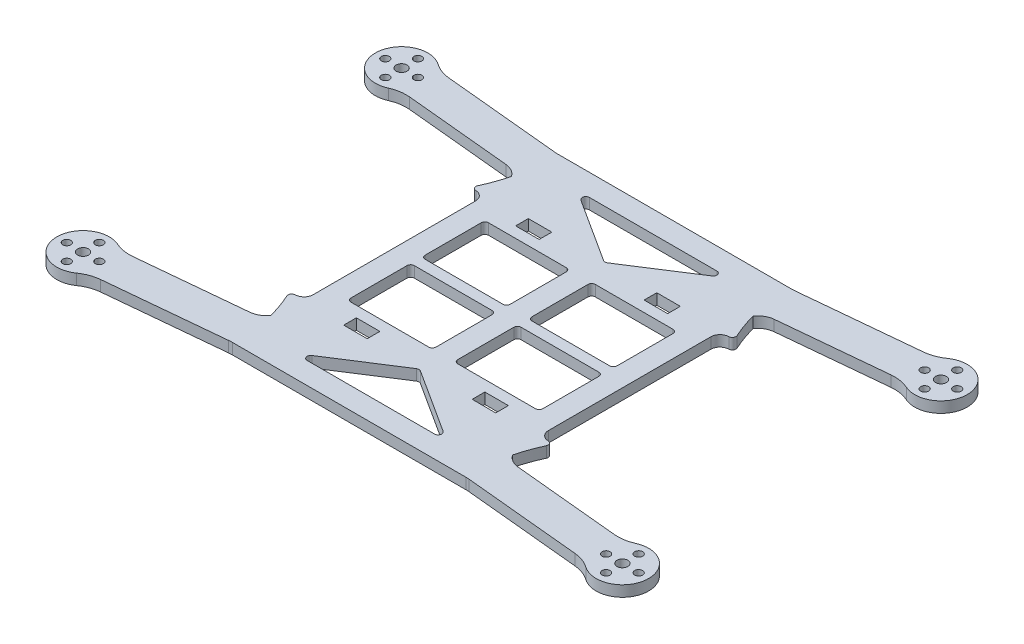
from build123d import *

# Parameters (mm, degrees)
SKETCH1_R           = 1.1
SKETCH1_R_2         = 1.099999998
SKETCH1_R_3         = 1.100000002
SKETCH1_R_4         = 1.100000004
SKETCH1_R_5         = 1.099999996
SKETCH1_R_6         = 1.5
BOSS_EXTRUDE1_DEPTH = 3
SKETCH2_W           = 6.5
SKETCH2_H           = 3.5
CUT_EXTRUDE1_DEPTH  = 3


with BuildPart() as part:
    # Sketch1 → Boss-Extrude1 (new body)
    with BuildSketch(Plane(origin=(0, 0, 0), x_dir=(1, 0, 0), z_dir=(0, 1, 0))):
        with BuildLine():
            Line((-65.541413555, 48.16007559), (-33.218669872, 45.046086874))
            ThreePointArc((-33.218669872, 45.046086874), (-32.739740879, 45.011528364), (-32.25970508, 45))
            Line((-32.25970508, 45), (32.25970508, 45))
            ThreePointArc((32.25970508, 45), (32.739740879, 45.011528364), (33.218669872, 45.046086874))
            Line((33.218669872, 45.046086874), (65.541413555, 48.16007559))
            ThreePointArc((65.541413555, 48.16007559), (68.051615849, 48.735029299), (70.331753828, 49.931966272))
            ThreePointArc((70.331753828, 49.931966272), (81.716587017, 44.695249474), (71.540883348, 37.381380156))
            ThreePointArc((71.540883348, 37.381380156), (69.074176187, 38.121003778), (66.500378347, 38.206162463))
            Line((66.500378347, 38.206162463), (37.020517604, 35.366058461))
            ThreePointArc((37.020517604, 35.366058461), (34.967820887, 34.700490182), (33.386772404, 33.231874971))
            ThreePointArc((33.386772404, 33.231874971), (34.463229219, 29.741424145), (35.835420758, 26.3562954))
            ThreePointArc((35.835420758, 26.3562954), (35.77253489, 25.409347753), (34.946904251, 24.941374967))
            ThreePointArc((34.946904251, 24.941374967), (33.213559493, 24.190832889), (32.5, 22.441938863))
            Line((32.5, 22.441938863), (32.5, -22.441938863))
            ThreePointArc((32.5, -22.441938863), (33.213559493, -24.190832889), (34.946904251, -24.941374967))
            ThreePointArc((34.946904251, -24.941374967), (35.77253489, -25.409347753), (35.835420758, -26.3562954))
            ThreePointArc((35.835420758, -26.3562954), (34.463229219, -29.741424145), (33.386772404, -33.231874971))
            ThreePointArc((33.386772404, -33.231874971), (34.967820887, -34.700490182), (37.020517604, -35.366058461))
            Line((37.020517604, -35.366058461), (66.500378347, -38.206162463))
            ThreePointArc((66.500378347, -38.206162463), (69.074176187, -38.121003778), (71.540883348, -37.381380156))
            ThreePointArc((71.540883348, -37.381380156), (81.716587017, -44.695249474), (70.331753828, -49.931966272))
            ThreePointArc((70.331753828, -49.931966272), (68.051615849, -48.735029299), (65.541413555, -48.16007559))
            Line((65.541413555, -48.16007559), (33.218669872, -45.046086874))
            ThreePointArc((33.218669872, -45.046086874), (32.739740879, -45.011528364), (32.25970508, -45))
            Line((32.25970508, -45), (-32.25970508, -45))
            ThreePointArc((-32.25970508, -45), (-32.739740879, -45.011528364), (-33.218669872, -45.046086874))
            Line((-33.218669872, -45.046086874), (-65.541413555, -48.16007559))
            ThreePointArc((-65.541413555, -48.16007559), (-68.051615849, -48.735029299), (-70.331753828, -49.931966272))
            ThreePointArc((-70.331753828, -49.931966272), (-81.716587017, -44.695249474), (-71.540883348, -37.381380156))
            ThreePointArc((-71.540883348, -37.381380156), (-69.074176187, -38.121003778), (-66.500378347, -38.206162463))
            Line((-66.500378347, -38.206162463), (-37.020517604, -35.366058461))
            ThreePointArc((-37.020517604, -35.366058461), (-34.967820887, -34.700490182), (-33.386772404, -33.231874971))
            ThreePointArc((-33.386772404, -33.231874971), (-34.463229219, -29.741424145), (-35.835420758, -26.3562954))
            ThreePointArc((-35.835420758, -26.3562954), (-35.77253489, -25.409347753), (-34.946904251, -24.941374967))
            ThreePointArc((-34.946904251, -24.941374967), (-33.213559493, -24.190832889), (-32.5, -22.441938863))
            Line((-32.5, -22.441938863), (-32.5, 22.441938863))
            ThreePointArc((-32.5, 22.441938863), (-33.213559493, 24.190832889), (-34.946904251, 24.941374967))
            ThreePointArc((-34.946904251, 24.941374967), (-35.77253489, 25.409347753), (-35.835420758, 26.3562954))
            ThreePointArc((-35.835420758, 26.3562954), (-34.463229219, 29.741424145), (-33.386772404, 33.231874971))
            ThreePointArc((-33.386772404, 33.231874971), (-34.967820887, 34.700490182), (-37.020517604, 35.366058461))
            Line((-37.020517604, 35.366058461), (-66.500378347, 38.206162463))
            ThreePointArc((-66.500378347, 38.206162463), (-69.074176187, 38.121003778), (-71.540883348, 37.381380156))
            ThreePointArc((-71.540883348, 37.381380156), (-81.716587017, 44.695249474), (-70.331753828, 49.931966272))
            ThreePointArc((-70.331753828, 49.931966272), (-68.051615849, 48.735029299), (-65.541413555, 48.16007559))
        make_face()
        with Locations(Location((-79, 44, 0), (0, 0, 270))):
            Circle(SKETCH1_R, mode=Mode.SUBTRACT)
        with Locations(Location((79, 44, 0), (0, 0, 270))):
            Circle(SKETCH1_R, mode=Mode.SUBTRACT)
        with Locations(Location((-74.500002544, 48.500002544, 0), (0, 0, 270))):
            Circle(SKETCH1_R_2, mode=Mode.SUBTRACT)
        with Locations(Location((-70, 44.000005089, 0), (0, 0, 270))):
            Circle(SKETCH1_R_3, mode=Mode.SUBTRACT)
        with Locations(Location((-74.499997456, 39.500002544, 0), (0, 0, 270))):
            Circle(SKETCH1_R_4, mode=Mode.SUBTRACT)
        with Locations(Location((-74.499997456, -39.500002544, 0), (0, 0, 270))):
            Circle(SKETCH1_R_3, mode=Mode.SUBTRACT)
        with Locations(Location((-70, -44.000005089, 0), (0, 0, 270))):
            Circle(SKETCH1_R_2, mode=Mode.SUBTRACT)
        with Locations(Location((-74.500002544, -48.500002544, 0), (0, 0, 270))):
            Circle(SKETCH1_R_5, mode=Mode.SUBTRACT)
        with Locations(Location((-79, -44, 0), (0, 0, 270))):
            Circle(SKETCH1_R, mode=Mode.SUBTRACT)
        with Locations(Location((79, -44, 0), (0, 0, 270))):
            Circle(SKETCH1_R, mode=Mode.SUBTRACT)
        with Locations(Location((74.500002544, -48.500002544, 0), (0, 0, 270))):
            Circle(SKETCH1_R_3, mode=Mode.SUBTRACT)
        with Locations(Location((70, -44.000005089, 0), (0, 0, 270))):
            Circle(SKETCH1_R_2, mode=Mode.SUBTRACT)
        with Locations(Location((74.499997456, -39.500002544, 0), (0, 0, 270))):
            Circle(SKETCH1_R_5, mode=Mode.SUBTRACT)
        with Locations(Location((74.499997456, 39.500002544, 0), (0, 0, 270))):
            Circle(SKETCH1_R_2, mode=Mode.SUBTRACT)
        with Locations(Location((70, 44.000005089, 0), (0, 0, 270))):
            Circle(SKETCH1_R_3, mode=Mode.SUBTRACT)
        with Locations(Location((74.500002544, 48.500002544, 0), (0, 0, 270))):
            Circle(SKETCH1_R_4, mode=Mode.SUBTRACT)
        with Locations(Location((-74.5, -44, 0), (0, 0, 270))):
            Circle(SKETCH1_R_6, mode=Mode.SUBTRACT)
        with Locations(Location((-74.5, 44, 0), (0, 0, 270))):
            Circle(SKETCH1_R_6, mode=Mode.SUBTRACT)
        with Locations(Location((74.5, 44, 0), (0, 0, 270))):
            Circle(SKETCH1_R_6, mode=Mode.SUBTRACT)
        with Locations(Location((74.5, -44, 0), (0, 0, 270))):
            Circle(SKETCH1_R_6, mode=Mode.SUBTRACT)
    extrude(amount=BOSS_EXTRUDE1_DEPTH)

    # Sketch2 → Cut-Extrude1 (cut)
    with BuildSketch(Plane(origin=(0, 3, 0), x_dir=(1, 0, 0), z_dir=(0, 1, 0))):
        with Locations((-17.75, 23.75)):
            Rectangle(SKETCH2_W, SKETCH2_H)
        with Locations((-17.75, -23.75)):
            Rectangle(SKETCH2_W, SKETCH2_H)
        with Locations((17.75, -23.75)):
            Rectangle(SKETCH2_W, SKETCH2_H)
        with Locations((17.75, 23.75)):
            Rectangle(SKETCH2_W, SKETCH2_H)
        with BuildLine():
            Line((-25.5, 19), (-4, 19))
            ThreePointArc((-4, 19), (-3.292893219, 18.707106781), (-3, 18))
            Line((-3, 18), (-3, 2.5))
            ThreePointArc((-3, 2.5), (-3.292893219, 1.792893219), (-4, 1.5))
            Line((-4, 1.5), (-25.5, 1.5))
            ThreePointArc((-25.5, 1.5), (-26.207106781, 1.792893219), (-26.5, 2.5))
            Line((-26.5, 2.5), (-26.5, 18))
            ThreePointArc((-26.5, 18), (-26.207106781, 18.707106781), (-25.5, 19))
        make_face()
        with BuildLine():
            Line((-25.5, -1.5), (-4, -1.5))
            ThreePointArc((-4, -1.5), (-3.292893219, -1.792893219), (-3, -2.5))
            Line((-3, -2.5), (-3, -18))
            ThreePointArc((-3, -18), (-3.292893219, -18.707106781), (-4, -19))
            Line((-4, -19), (-25.5, -19))
            ThreePointArc((-25.5, -19), (-26.207106781, -18.707106781), (-26.5, -18))
            Line((-26.5, -18), (-26.5, -2.5))
            ThreePointArc((-26.5, -2.5), (-26.207106781, -1.792893219), (-25.5, -1.5))
        make_face()
        with BuildLine():
            Line((4, 19), (25.5, 19))
            ThreePointArc((25.5, 19), (26.207106781, 18.707106781), (26.5, 18))
            Line((26.5, 18), (26.5, 2.5))
            ThreePointArc((26.5, 2.5), (26.207106781, 1.792893219), (25.5, 1.5))
            Line((25.5, 1.5), (4, 1.5))
            ThreePointArc((4, 1.5), (3.292893219, 1.792893219), (3, 2.5))
            Line((3, 2.5), (3, 18))
            ThreePointArc((3, 18), (3.292893219, 18.707106781), (4, 19))
        make_face()
        with BuildLine():
            Line((4, -1.5), (25.5, -1.5))
            ThreePointArc((25.5, -1.5), (26.207106781, -1.792893219), (26.5, -2.5))
            Line((26.5, -2.5), (26.5, -18))
            ThreePointArc((26.5, -18), (26.207106781, -18.707106781), (25.5, -19))
            Line((25.5, -19), (4, -19))
            ThreePointArc((4, -19), (3.292893219, -18.707106781), (3, -18))
            Line((3, -18), (3, -2.5))
            ThreePointArc((3, -2.5), (3.292893219, -1.792893219), (4, -1.5))
        make_face()
        with BuildLine():
            Line((-17.595187003, 39), (17.595187003, 39))
            ThreePointArc((17.595187003, 39), (18.554660419, 38.281799152), (18.135944594, 37.158821525))
            Line((18.135944594, 37.158821525), (0.540757591, 25.84762988))
            ThreePointArc((0.540757591, 25.84762988), (0, 25.688808356), (-0.540757591, 25.84762988))
            Line((-0.540757591, 25.84762988), (-18.135944594, 37.158821525))
            ThreePointArc((-18.135944594, 37.158821525), (-18.554660419, 38.281799152), (-17.595187003, 39))
        make_face()
        with BuildLine():
            Line((-17.595187003, -39), (17.595187003, -39))
            ThreePointArc((17.595187003, -39), (18.554660419, -38.281799152), (18.135944594, -37.158821525))
            Line((18.135944594, -37.158821525), (0.540757591, -25.84762988))
            ThreePointArc((0.540757591, -25.84762988), (0, -25.688808356), (-0.540757591, -25.84762988))
            Line((-0.540757591, -25.84762988), (-18.135944594, -37.158821525))
            ThreePointArc((-18.135944594, -37.158821525), (-18.554660419, -38.281799152), (-17.595187003, -39))
        make_face()
    extrude(amount=-CUT_EXTRUDE1_DEPTH, mode=Mode.SUBTRACT)


solid = part.part
